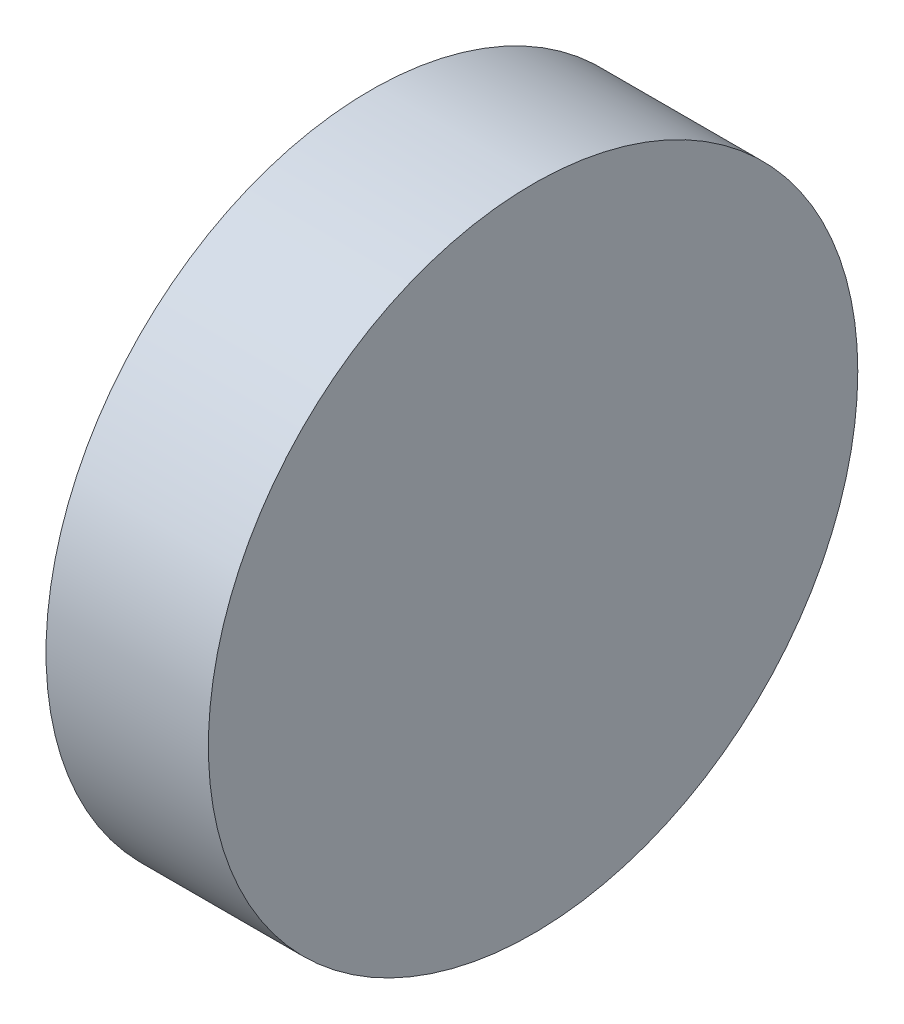
from build123d import *

# Parameters (mm, degrees)
SKETCH1_R           = 200
BOSS_EXTRUDE1_DEPTH = 100


with BuildPart() as part:
    # Sketch1 → Boss-Extrude1 (new body)
    with BuildSketch(Plane(origin=(0, 0, 0), x_dir=(0, 0, -1), z_dir=(1, 0, 0))):
        with Locations((0, 1.336441438)):
            Circle(SKETCH1_R)
    extrude(amount=BOSS_EXTRUDE1_DEPTH)


solid = part.part
